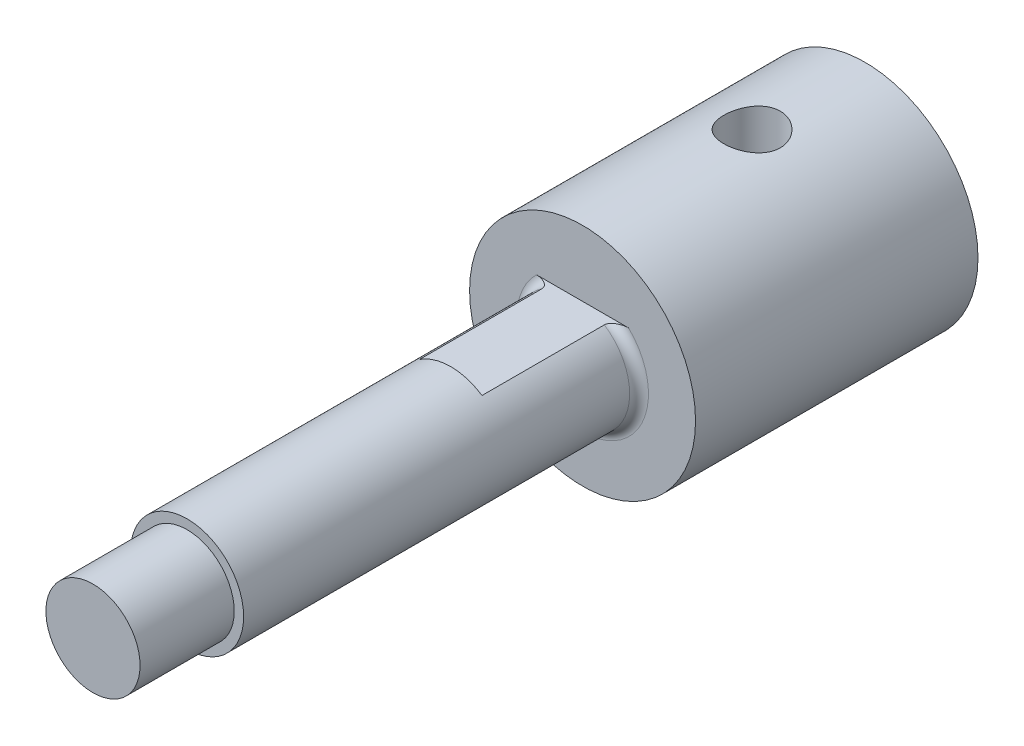
from build123d import *

# Parameters (mm, degrees)
SKETCH1_R           = 6
SKETCH1_R_2         = 3
BOSS_EXTRUDE1_DEPTH = 11
SKETCH2_R           = 1.5
CUT_EXTRUDE1_DEPTH  = 14.892443989
SKETCH3_R           = 6
BOSS_EXTRUDE2_DEPTH = 4
BOSS_EXTRUDE3_DEPTH = 7
SKETCH5_R           = 3
BOSS_EXTRUDE6_DEPTH = 14
SKETCH7_R           = 2.5
BOSS_EXTRUDE7_DEPTH = 5
FILLET1_R           = 0.5
ECHELLE1_SCALE      = 2
ECHELLE2_SCALE      = 0.25


with BuildPart() as part:
    # Sketch1 → Boss-Extrude1 (new body)
    with BuildSketch(Plane.XY):
        Circle(SKETCH1_R)
        Circle(SKETCH1_R_2, mode=Mode.SUBTRACT)
    extrude(amount=BOSS_EXTRUDE1_DEPTH)

    # Sketch2 → Cut-Extrude1 (cut, through all)
    with BuildSketch(Plane(origin=(0, 0, 0), x_dir=(1, 0, 0), z_dir=(0, 1, 0))):
        with Locations(Location((0, -6, 0), (0, 0, 90))):
            Circle(SKETCH2_R)
    extrude(amount=CUT_EXTRUDE1_DEPTH, mode=Mode.SUBTRACT)

    # Sketch3 → Boss-Extrude2 (add)
    with BuildSketch(Plane.XY.offset(11)):
        Circle(SKETCH3_R)
    extrude(amount=BOSS_EXTRUDE2_DEPTH)

    # Sketch4 → Boss-Extrude3 (add)
    with BuildSketch(Plane.XY.offset(15)):
        with BuildLine():
            Line((-1.658312395, 2.5), (1.658312395, 2.5))
            ThreePointArc((1.658312395, 2.5), (0, -3), (-1.658312395, 2.5))
        make_face()
    extrude(amount=BOSS_EXTRUDE3_DEPTH)

    # Sketch5 → Boss-Extrude6 (add)
    with BuildSketch(Plane.XY.offset(22)):
        Circle(SKETCH5_R)
    extrude(amount=BOSS_EXTRUDE6_DEPTH)

    # Sketch7 → Boss-Extrude7 (add)
    with BuildSketch(Plane.XY.offset(36)):
        Circle(SKETCH7_R)
    extrude(amount=BOSS_EXTRUDE7_DEPTH)

    # Fillet1
    fillet1_edges = [part.edges().sort_by_distance(p)[0] for p in [
        (0, -3, 15),
    ]]
    fillet(fillet1_edges, radius=FILLET1_R)


with BuildPart() as part_1:
    # Echelle1: scaled about (-5.064e-06, -0.057271287, 14.482309023)
    add(part.part.scale(ECHELLE1_SCALE).moved(Location((5.064e-06, 0.057271287, -14.482309023))))


with BuildPart() as part_2:
    # Echelle2: scaled about (-5.063e-06, -0.057271287, 14.482309023)
    add(part_1.part.scale(ECHELLE2_SCALE).moved(Location((-3.797e-06, -0.042953465, 10.861731767))))


solid = part_2.part
